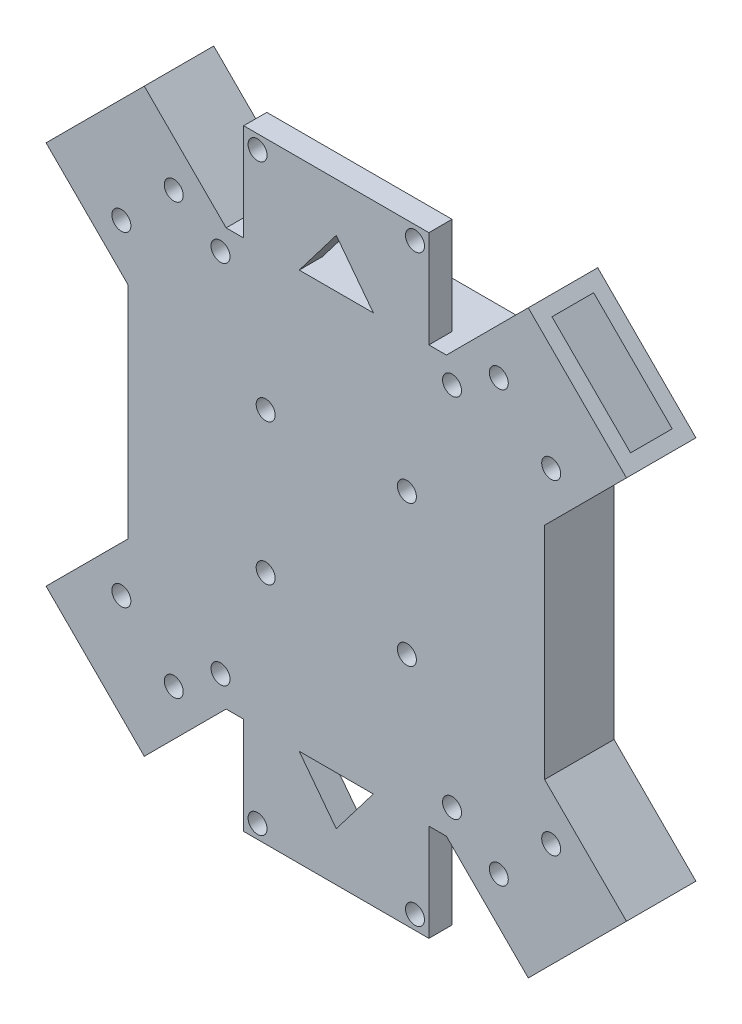
from build123d import *

# Parameters (mm, degrees)
SKETCH1_W           = 90
SKETCH1_H           = 90
SKETCH1_R           = 2.05
BOSS_EXTRUDE1_DEPTH = 15
BOSS_EXTRUDE2_DEPTH = 15
SKETCH4_R           = 2.05
CUT_EXTRUDE1_DEPTH  = 15
SKETCH6_W           = 24
SKETCH6_H           = 9.009591428
CUT_EXTRUDE2_DEPTH  = 22
SKETCH9_W           = 24
SKETCH9_H           = 9
CUT_EXTRUDE3_DEPTH  = 22
SKETCH7_W           = 24
SKETCH7_H           = 9
CUT_EXTRUDE4_DEPTH  = 22
SKETCH8_W           = 24
SKETCH8_H           = 9
CUT_EXTRUDE5_DEPTH  = 22
SKETCH10_R          = 2.05
BOSS_EXTRUDE3_DEPTH = 5


with BuildPart() as part:
    # Sketch1 → Boss-Extrude1 (new body)
    with BuildSketch(Plane(origin=(0, 0, 0), x_dir=(0, 1, 0), z_dir=(0, 0, 1))):
        with Locations((-1.369565217, -20.064677945)):
            Rectangle(SKETCH1_W, SKETCH1_H)
        with Locations(Location((-40.369565217, 4.935322055, 0), (0, 0, 270))):
            Circle(SKETCH1_R, mode=Mode.SUBTRACT)
        with Locations(Location((-40.369565217, -45.064677945, 0), (0, 0, 270))):
            Circle(SKETCH1_R, mode=Mode.SUBTRACT)
        with Locations(Location((38.630434783, 4.935322055, 0), (0, 0, 270))):
            Circle(SKETCH1_R, mode=Mode.SUBTRACT)
        with Locations(Location((38.630434783, -45.064677945, 0), (0, 0, 270))):
            Circle(SKETCH1_R, mode=Mode.SUBTRACT)
        with Locations(Location((13.880434783, -4.814677945, 0), (0, 0, 270))):
            Circle(SKETCH1_R, mode=Mode.SUBTRACT)
        with Locations(Location((-16.619565217, -4.814677945, 0), (0, 0, 270))):
            Circle(SKETCH1_R, mode=Mode.SUBTRACT)
        with Locations(Location((13.880434783, -35.314677945, 0), (0, 0, 270))):
            Circle(SKETCH1_R, mode=Mode.SUBTRACT)
        with Locations(Location((-16.619565217, -35.314677945, 0), (0, 0, 270))):
            Circle(SKETCH1_R, mode=Mode.SUBTRACT)
    extrude(amount=BOSS_EXTRUDE1_DEPTH)

    # Sketch2 → Boss-Extrude2 (add)
    with BuildSketch(Plane.XY.offset(15)):
        Polygon((-21.399788149, 61.308104312), (-42.612991584, 40.094900877), (-24.935322055, 22.417231347), (-24.935322055, 43.630434783), (-3.722118619, 43.630434783), align=None)
        Polygon((-24.935322055, -25.156361782), (-42.612991584, -42.834031311), (-21.399788149, -64.047234747), (-3.722118619, -46.369565217), (-24.935322055, -46.369565217), align=None)
        Polygon((61.529144039, 61.308104312), (43.85147451, 43.630434783), (65.064677945, 43.630434783), (65.064677945, 22.417231347), (82.742347475, 40.094900877), align=None)
        Polygon((43.85147451, -46.369565217), (61.529144039, -64.047234747), (82.742347475, -42.834031311), (65.064677945, -25.156361782), (65.064677945, -46.369565217), align=None)
    extrude(amount=-BOSS_EXTRUDE2_DEPTH)

    # Sketch4 → Cut-Extrude1 (cut)
    with BuildSketch(Plane.XY.offset(15)):
        with Locations((-26.349535617, 33.730939846)):
            Circle(SKETCH4_R)
        with Locations((-15.035827118, 45.044648345)):
            Circle(SKETCH4_R)
        with Locations(Location((66.478891508, 33.730939846, 0), (0, 0, 180))):
            Circle(SKETCH4_R)
        with Locations(Location((55.165183009, 45.044648345, 0), (0, 0, 180))):
            Circle(SKETCH4_R)
        with Locations((66.478891508, -36.470070281)):
            Circle(SKETCH4_R)
        with Locations((55.165183009, -47.78377878)):
            Circle(SKETCH4_R)
        with Locations(Location((-15.035827118, -47.78377878, 0), (0, 0, 180))):
            Circle(SKETCH4_R)
        with Locations(Location((-26.349535617, -36.470070281, 0), (0, 0, 180))):
            Circle(SKETCH4_R)
    extrude(amount=-CUT_EXTRUDE1_DEPTH, mode=Mode.SUBTRACT)

    # Sketch6 → Cut-Extrude2 (cut)
    with BuildSketch(Plane(origin=(-41.35394623, 41.35394623, 0), x_dir=(-0.7071067811865476, -0.7071067811865476, 0), z_dir=(-0.7071067811865476, 0.7071067811865476, 0))):
        with Locations((-13.219440985, 7.504795714)):
            Rectangle(SKETCH6_W, SKETCH6_H)
    extrude(amount=-CUT_EXTRUDE2_DEPTH, mode=Mode.SUBTRACT)

    # Sketch9 → Cut-Extrude3 (cut)
    with BuildSketch(Plane(origin=(61.418624176, 61.418624176, 0), x_dir=(-0.7071067811865479, 0.7071067811865472, 0), z_dir=(0.7071067811865472, 0.7071067811865479, 0))):
        with Locations((-15.15629869, 7.5)):
            Rectangle(SKETCH9_W, SKETCH9_H)
    extrude(amount=-CUT_EXTRUDE3_DEPTH, mode=Mode.SUBTRACT)

    # Sketch7 → Cut-Extrude4 (cut)
    with BuildSketch(Plane(origin=(-42.723511448, -42.723511448, 0), x_dir=(0.7071067811865483, -0.7071067811865468, 0), z_dir=(-0.7071067811865468, -0.7071067811865483, 0))):
        with Locations((15.15629869, 7.5)):
            Rectangle(SKETCH7_W, SKETCH7_H)
    extrude(amount=-CUT_EXTRUDE4_DEPTH, mode=Mode.SUBTRACT)

    # Sketch8 → Cut-Extrude5 (cut)
    with BuildSketch(Plane(origin=(62.788189393, -62.788189393, 0), x_dir=(0.7071067811865461, 0.707106781186549, 0), z_dir=(0.707106781186549, -0.7071067811865461, 0))):
        with Locations((13.219440985, 7.5)):
            Rectangle(SKETCH8_W, SKETCH8_H)
    extrude(amount=-CUT_EXTRUDE5_DEPTH, mode=Mode.SUBTRACT)

    # Sketch10 → Boss-Extrude3 (add)
    # profile 1 of 2: a face of its own
    with BuildSketch(Plane.XY.offset(15)):
        Polygon((40.064677945, 64.630434783), (0.064677945, 64.630434783), (0.064677945, 43.630434783), (12.064677945, 43.630434783), (20.064677945, 54.130434783), (28.064677945, 43.630434783), (40.064677945, 43.630434783), align=None)
        with Locations((3.064677945, 61.630434783)):
            Circle(SKETCH10_R, mode=Mode.SUBTRACT)
        with Locations((37.064677945, 61.630434783)):
            Circle(SKETCH10_R, mode=Mode.SUBTRACT)
    # profile 2 of 2: a face of its own
    with BuildSketch(Plane.XY.offset(15)):
        Polygon((12.064677945, -46.369565217), (0.064677945, -46.369565217), (0.064677945, -67.369565217), (40.064677945, -67.369565217), (40.064677945, -46.369565217), (28.064677945, -46.369565217), (20.064677945, -56.869565217), align=None)
        with Locations((3.064677945, -64.369565217)):
            Circle(SKETCH10_R, mode=Mode.SUBTRACT)
        with Locations((37.064677945, -64.369565217)):
            Circle(SKETCH10_R, mode=Mode.SUBTRACT)
    extrude(amount=-BOSS_EXTRUDE3_DEPTH)


solid = part.part
